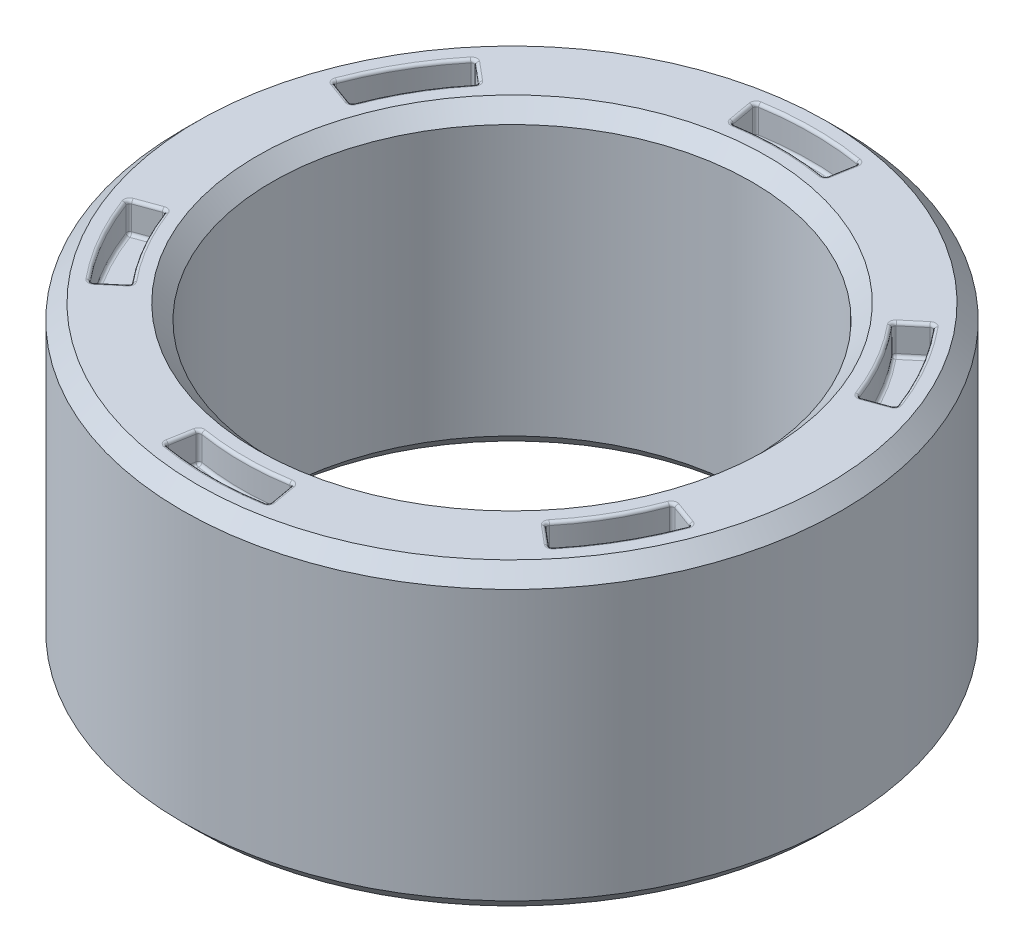
from build123d import *

# Parameters (mm, degrees)
SKETCH1_R                = 11
SKETCH1_R_2              = 8
BOSS_EXTRUDE1_DEPTH      = 10
CHAMFER1_SIZE            = 0.5
CUT_EXTRUDE1_DEPTH       = 1
FILLET1_R                = 0.1
CIRPATTERN1_COUNT        = 6
FILLET1_OF_CIRPATTERN1_R = 0.1


with BuildPart() as part:
    # Sketch1 → Boss-Extrude1 (new body)
    with BuildSketch(Plane(origin=(0, 0, 0), x_dir=(1, 0, 0), z_dir=(0, 1, 0))):
        with Locations(Location((0, 0, 0), (0, 0, 270))):
            Circle(SKETCH1_R)
        with Locations(Location((0, 0, 0), (0, 0, 270))):
            Circle(SKETCH1_R_2, mode=Mode.SUBTRACT)
    extrude(amount=BOSS_EXTRUDE1_DEPTH)

    # Chamfer1
    chamfer1_edges = [part.edges().sort_by_distance(p)[0] for p in [
        (0, 0, -11),
        (0, 10, -11),
        (0, 0, -8),
        (0, 10, -8),
    ]]
    chamfer(chamfer1_edges, length=CHAMFER1_SIZE)

    # Sketch2 → Cut-Extrude1 (cut)
    with BuildSketch(Plane(origin=(0, 10, 0), x_dir=(1, 0, 0), z_dir=(0, 1, 0))):
        with BuildLine():
            Line((-1.562833599, 8.863269777), (-1.736481777, 9.84807753))
            ThreePointArc((-1.736481777, 9.84807753), (0, 10), (1.736481777, 9.84807753))
            Line((1.736481777, 9.84807753), (1.562833599, 8.863269777))
            ThreePointArc((1.562833599, 8.863269777), (0, 9), (-1.562833599, 8.863269777))
        make_face()
    cut_extrude1 = extrude(amount=-CUT_EXTRUDE1_DEPTH, mode=Mode.SUBTRACT)

    # Fillet1
    fillet1_edges = [part.edges().sort_by_distance(p)[0] for p in [
        (0, 9, -9),
        (1.562833599, 9.5, -8.863269777),
        (-1.649657688, 9, -9.355673654),
        (-1.562833599, 9.5, -8.863269777),
        (0, 9, -10),
        (-1.736481777, 9.5, -9.84807753),
        (1.649657688, 9, -9.355673654),
        (1.736481777, 9.5, -9.84807753),
        (0, 10, -9),
        (1.649657688, 10, -9.355673654),
        (0, 10, -10),
        (-1.649657688, 10, -9.355673654),
    ]]
    fillet(fillet1_edges, radius=FILLET1_R)

    # CirPattern1: Cut-Extrude1 ×6 about axis
    cirpattern1_axis = Axis((0, 0, 0), (0, 1, 0))
    for i in range(1, CIRPATTERN1_COUNT):
        add(cut_extrude1.rotate(cirpattern1_axis, i * 360 / CIRPATTERN1_COUNT), mode=Mode.SUBTRACT)

    # Fillet1 of CirPattern1
    fillet1_of_cirpattern1_edges = [part.edges().sort_by_distance(p)[0] for p in [
        (-7.794228634, 9, -4.5),
        (-6.894399988, 9.5, -5.785088487),
        (-8.927079897, 9, -3.249191362),
        (-8.457233587, 9.5, -3.07818129),
        (-8.660254038, 9, -5),
        (-9.396926208, 9.5, -3.420201433),
        (-7.27742221, 9, -6.106482292),
        (-7.660444431, 9.5, -6.427876097),
        (-7.794228634, 10, -4.5),
        (-7.27742221, 10, -6.106482292),
        (-8.660254038, 10, -5),
        (-8.927079897, 10, -3.249191362),
        (-7.794228634, 9, 4.5),
        (-8.457233587, 9.5, 3.07818129),
        (-7.27742221, 9, 6.106482292),
        (-6.894399988, 9.5, 5.785088487),
        (-8.660254038, 9, 5),
        (-7.660444431, 9.5, 6.427876097),
        (-8.927079897, 9, 3.249191362),
        (-9.396926208, 9.5, 3.420201433),
        (-7.794228634, 10, 4.5),
        (-8.927079897, 10, 3.249191362),
        (-8.660254038, 10, 5),
        (-7.27742221, 10, 6.106482292),
        (0, 9, 9),
        (-1.562833599, 9.5, 8.863269777),
        (1.649657688, 9, 9.355673654),
        (1.562833599, 9.5, 8.863269777),
        (0, 9, 10),
        (1.736481777, 9.5, 9.84807753),
        (-1.649657688, 9, 9.355673654),
        (-1.736481777, 9.5, 9.84807753),
        (0, 10, 9),
        (-1.649657688, 10, 9.355673654),
        (0, 10, 10),
        (1.649657688, 10, 9.355673654),
        (7.794228634, 9, 4.5),
        (6.894399988, 9.5, 5.785088487),
        (8.927079897, 9, 3.249191362),
        (8.457233587, 9.5, 3.07818129),
        (8.660254038, 9, 5),
        (9.396926208, 9.5, 3.420201433),
        (7.27742221, 9, 6.106482292),
        (7.660444431, 9.5, 6.427876097),
        (7.794228634, 10, 4.5),
        (7.27742221, 10, 6.106482292),
        (8.660254038, 10, 5),
        (8.927079897, 10, 3.249191362),
        (7.794228634, 9, -4.5),
        (8.457233587, 9.5, -3.07818129),
        (7.27742221, 9, -6.106482292),
        (6.894399988, 9.5, -5.785088487),
        (8.660254038, 9, -5),
        (7.660444431, 9.5, -6.427876097),
        (8.927079897, 9, -3.249191362),
        (9.396926208, 9.5, -3.420201433),
        (7.794228634, 10, -4.5),
        (8.927079897, 10, -3.249191362),
        (8.660254038, 10, -5),
        (7.27742221, 10, -6.106482292),
    ]]
    fillet(fillet1_of_cirpattern1_edges, radius=FILLET1_OF_CIRPATTERN1_R)


solid = part.part
